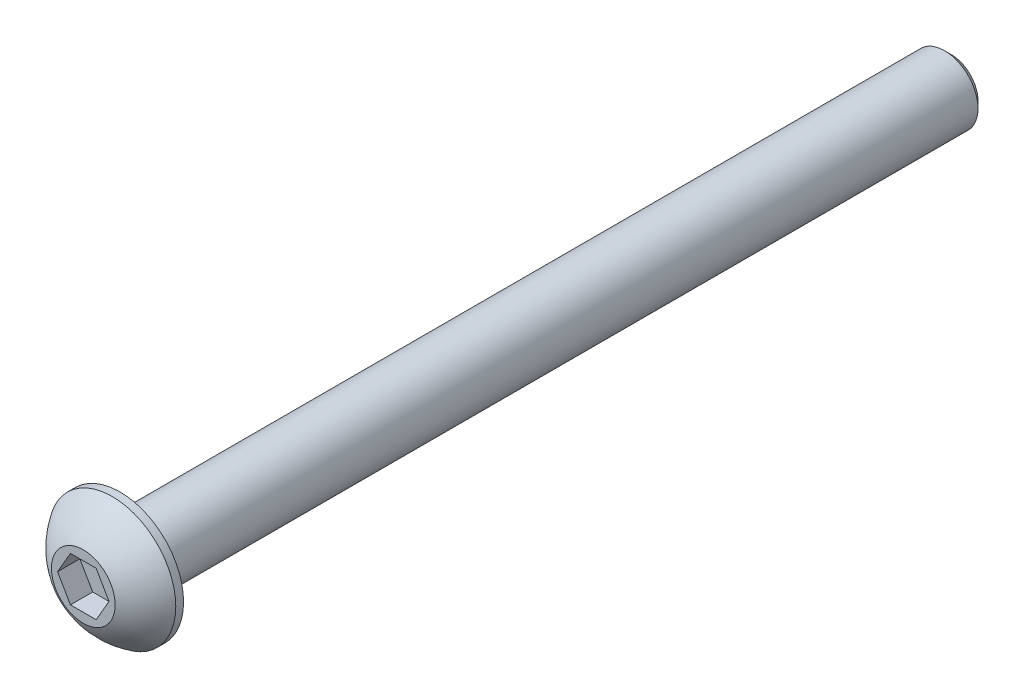
from build123d import *

# Parameters (mm, degrees)
CUT_EXTRUDE_1_DEPTH = 1
CHAMFER_2_SIZE      = 0.3


with BuildPart() as part:
    # 草图1 → 旋转1 (revolve)
    with BuildSketch(Plane(origin=(0, 0, 0), x_dir=(0, 0, -1), z_dir=(1, 0, 0)), mode=Mode.PRIVATE) as revolve_1_sk:
        with BuildLine():
            Line((0, 1.5), (0, 2.85))
            Line((0, 2.85), (-0.35, 2.85))
            ThreePointArc((-0.35, 2.85), (-1.098097646, 2.229807704), (-1.65, 1.43))
            Line((-1.65, 1.43), (-1.65, 0))
            Line((-1.65, 0), (0, 0))
            Line((0, 0), (37.3, 0))
            Line((37.3, 0), (37.3, 1.5))
            Line((37.3, 1.5), (0, 1.5))
        make_face()
    revolve(revolve_1_sk.sketch.rotate(Axis((0, 0, 0), (0, 0, -1)), 90), axis=Axis((0, 0, 0), (0, 0, -1)))

    # 草图2 → 切除-拉伸1 (cut)
    with BuildSketch(Plane.XY.offset(1.65)):
        Polygon((-0.577350269, 1), (-1.154700538, 0), (-0.577350269, -1), (0.577350269, -1), (1.154700538, 0), (0.577350269, 1), align=None)
    extrude(amount=-CUT_EXTRUDE_1_DEPTH, mode=Mode.SUBTRACT)

    # 倒角2
    chamfer_2_edges = [part.edges().sort_by_distance(p)[0] for p in [
        (-1.5, 0, -37.3),
    ]]
    chamfer(chamfer_2_edges, length=CHAMFER_2_SIZE)


solid = part.part
